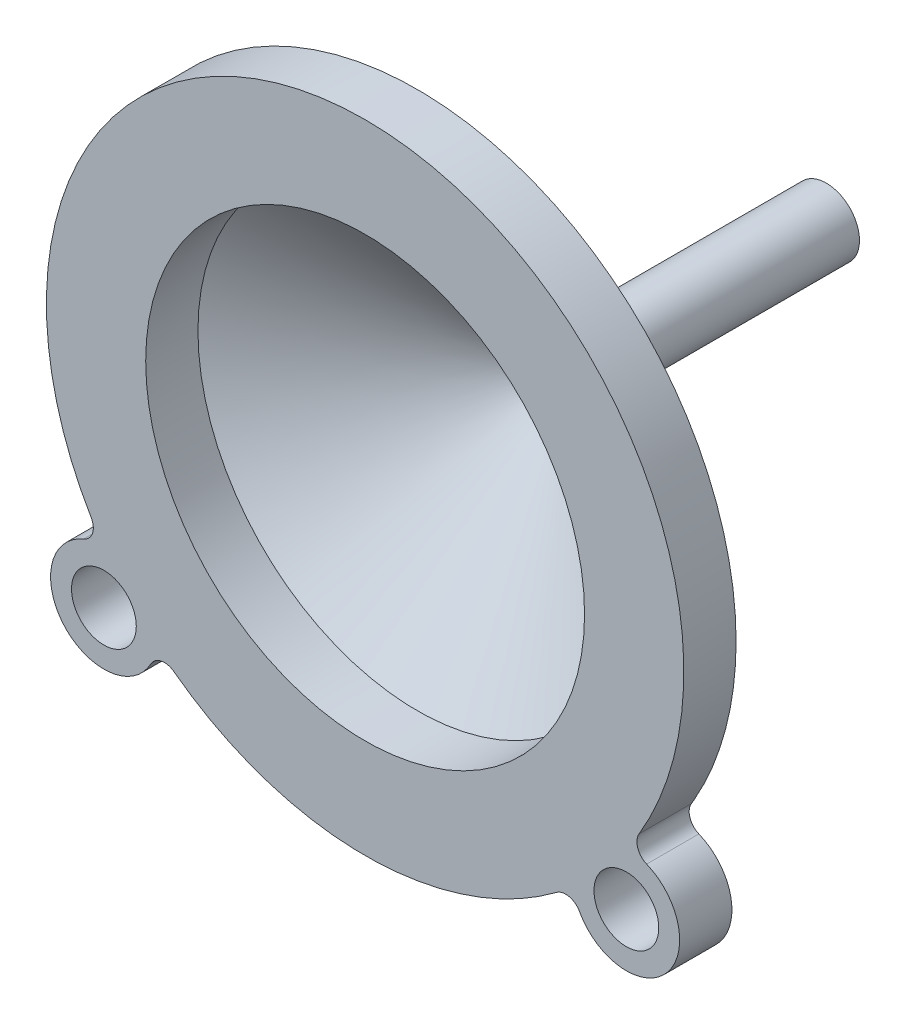
from build123d import *

# Parameters (mm, degrees)
ESBO_O1_R                = 21
ESBO_O1_R_2              = 3.1
RESSALTO_EXTRUS_O1_DEPTH = 5
ESBO_O3_R                = 7.5
CORTE_EXTRUS_O1_DEPTH    = 19


with BuildPart() as part:
    # Esboço1 → Ressalto-extrusão1 (new body)
    with BuildSketch(Plane.XY):
        with BuildLine():
            ThreePointArc((26.22105388, -15.579035061), (0, 30.5), (-26.22105388, -15.579035061))
            ThreePointArc((-26.22105388, -15.579035061), (-26.087819075, -16.82024855), (-26.940019837, -17.73245264))
            ThreePointArc((-26.940019837, -17.73245264), (-28.794642857, -25.856499042), (-20.518582449, -24.883575301))
            ThreePointArc((-20.518582449, -24.883575301), (-19.520268693, -24.134087419), (-18.30049416, -24.399629372))
            ThreePointArc((-18.30049416, -24.399629372), (0, -30.5), (18.30049416, -24.399629372))
            ThreePointArc((18.30049416, -24.399629372), (19.520268693, -24.134087419), (20.518582449, -24.883575301))
            ThreePointArc((20.518582449, -24.883575301), (28.794642857, -25.856499042), (26.940019837, -17.73245264))
            ThreePointArc((26.940019837, -17.73245264), (26.087819075, -16.82024855), (26.22105388, -15.579035061))
        make_face()
        Circle(ESBO_O1_R, mode=Mode.SUBTRACT)
        with Locations((25, -22.449053432)):
            Circle(ESBO_O1_R_2, mode=Mode.SUBTRACT)
        with Locations((-25, -22.449053432)):
            Circle(ESBO_O1_R_2, mode=Mode.SUBTRACT)
    extrude(amount=RESSALTO_EXTRUS_O1_DEPTH)

    # Esboço2 → Revolução1 (revolve)
    with BuildSketch(Plane(origin=(0, 0, 0), x_dir=(1, 0, 0), z_dir=(0, 1, 0))):
        Polygon((30.5, 0), (3.175, 19.133170982), (3.175, 39.133170982), (1.675, 39.133170982), (1.675, 13.531510676), (21, 0), align=None)
    revolve(axis=Axis((0, 0, 0), (0, 0, -1)))

    # Esboço3 → Corte-extrusão1 (cut)
    with BuildSketch(Plane(origin=(0, 0, 0), x_dir=(-1, 0, 0), z_dir=(0, 0, -1))):
        with Locations((-25, -22.449053432)):
            Circle(ESBO_O3_R)
        with Locations((25, -22.449053432)):
            Circle(ESBO_O3_R)
    extrude(amount=CORTE_EXTRUS_O1_DEPTH, mode=Mode.SUBTRACT)


solid = part.part
